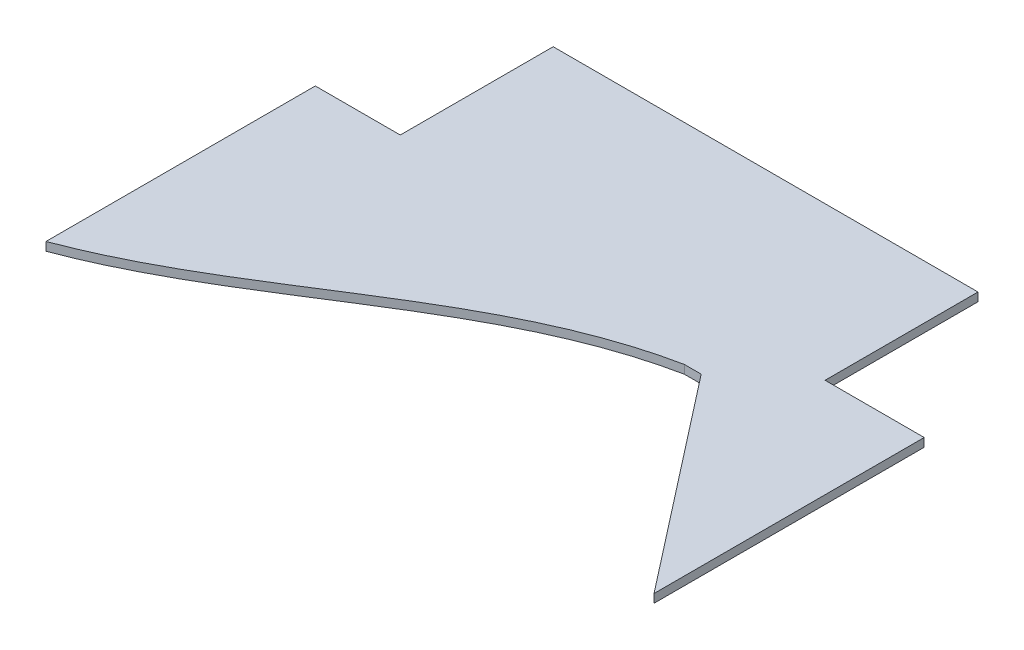
from build123d import *

# Parameters (mm, degrees)
BOSS_EXTRUDE1_DEPTH = 3


with BuildPart() as part:
    # Sketch1 → Boss-Extrude1 (new body)
    with BuildSketch(Plane(origin=(0, 0, 0), x_dir=(1, 0, 0), z_dir=(0, 1, 0))):
        with BuildLine():
            add(Edge.make_bspline(
                [(45.281536872, -37), (-12.284726177, -48.689174516), (-51.82483075, -92.30412262), (-105, -112.092029096)],
                knots=[0, 0, 0, 0, 1, 1, 1, 1], degree=3))
            Line((45.281536872, -37), (51.259707723, -37))
            Line((51.259707723, -37), (110, -112.392253356))
            Line((110, -112.392253356), (110, -17))
            Line((110, -17), (75, -17))
            Line((75, -17), (75, 37))
            Line((75, 37), (-75, 37))
            Line((-75, 37), (-75, -17))
            Line((-75, -17), (-105, -17))
            Line((-105, -17), (-105, -112.092029096))
        make_face()
    extrude(amount=BOSS_EXTRUDE1_DEPTH)


solid = part.part
